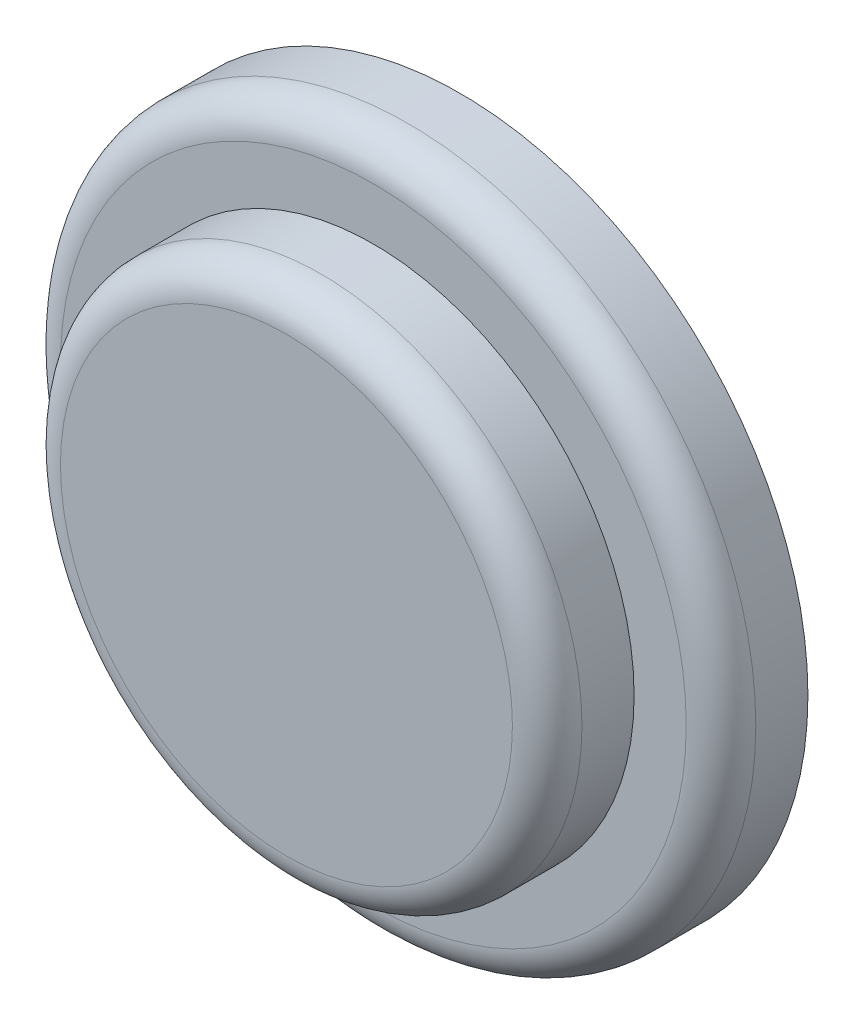
from build123d import *

# Parameters (mm, degrees)
SKETCH_1_R          = 20
EXTRUDE_1_DEPTH     = 10
SKETCH_2_R          = 10
CUT_EXTRUDE_1_DEPTH = 5
CUT_EXTRUDE_START   = -5
SKETCH_3_R          = 20
SKETCH_3_R_2        = 15
CUT_EXTRUDE_3_DEPTH = 5
FILLET_1_R          = 2
FILLET_2_R          = 2


with BuildPart() as part:
    # 草图1 → 凸台-拉伸1 (new body)
    with BuildSketch(Plane.XY):
        Circle(SKETCH_1_R)
    extrude(amount=EXTRUDE_1_DEPTH)

    # 草图2 → 切除-拉伸1 (cut)
    with BuildSketch(Plane(origin=(0, 0, 0), x_dir=(-1, 0, 0), z_dir=(0, 0, -1))):
        Circle(SKETCH_2_R)
    extrude(amount=-CUT_EXTRUDE_1_DEPTH, mode=Mode.SUBTRACT)

    # 草图3 → 切除-拉伸3 (cut)
    with BuildSketch(Plane.XY.offset(10).offset(CUT_EXTRUDE_START)):
        Circle(SKETCH_3_R)
        Circle(SKETCH_3_R_2, mode=Mode.SUBTRACT)
    extrude(amount=CUT_EXTRUDE_3_DEPTH, mode=Mode.SUBTRACT)

    # 圆角1
    fillet_1_edges = [part.edges().sort_by_distance(p)[0] for p in [
        (-15, 0, 10),
    ]]
    fillet(fillet_1_edges, radius=FILLET_1_R)

    # 圆角2
    fillet_2_edges = [part.edges().sort_by_distance(p)[0] for p in [
        (-20, 0, 5),
    ]]
    fillet(fillet_2_edges, radius=FILLET_2_R)


solid = part.part
